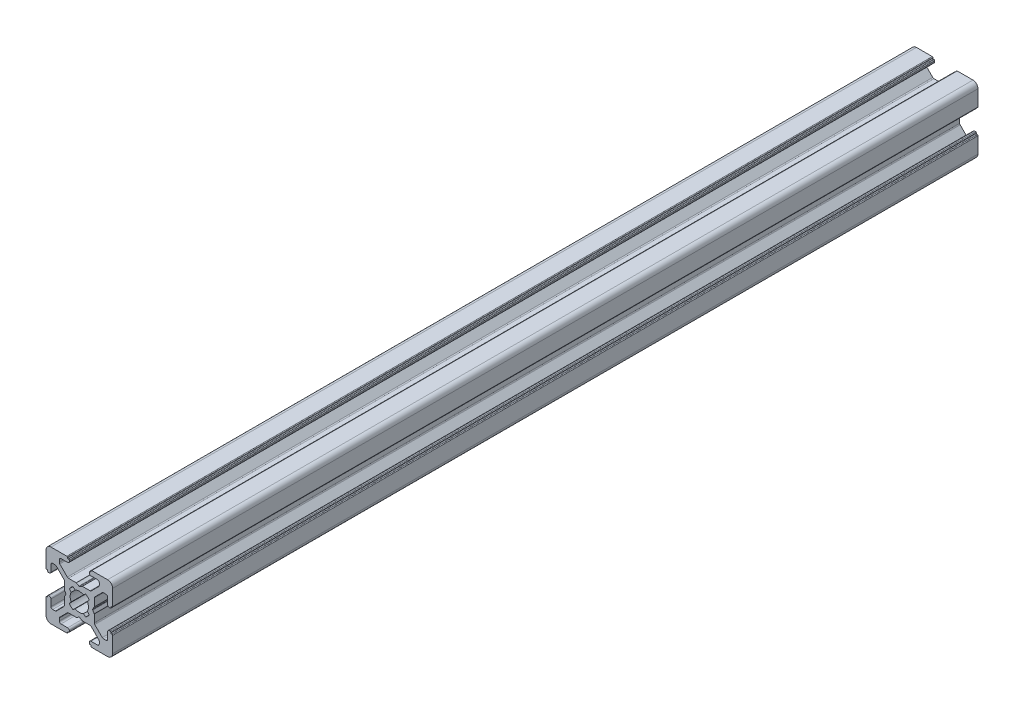
from build123d import *

# Parameters (mm, degrees)
EXTRUDE1_DEPTH = 260


with BuildPart() as part:
    # Sketch1 → Extrude1 (new body)
    with BuildSketch(Plane.XY):
        with BuildLine():
            Line((-3.5, 8.499999673), (-5.500000686, 8.499999673))
            ThreePointArc((-5.500000686, 8.499999673), (-5.853554077, 8.353553064), (-6.000000686, 7.999999673))
            Line((-6.000000686, 7.999999673), (-6.000000686, 7.267766626))
            ThreePointArc((-6.000000686, 7.267766626), (-5.961940448, 7.076424899), (-5.853554059, 6.914213219))
            Line((-5.853554059, 6.914213219), (-3.585787212, 4.646446592))
            ThreePointArc((-3.585787212, 4.646446592), (-3.423575544, 4.538060229), (-3.232233839, 4.5))
            Line((-3.232233839, 4.5), (-0.953590312, 4.5))
            ThreePointArc((-0.953590312, 4.5), (-0.901826505, 4.493185166), (-0.853590316, 4.473205083))
            Line((-0.853590316, 4.473205083), (-0.100000045, 4.038119562))
            ThreePointArc((-0.100000045, 4.038119562), (0, 4.011324632), (0.100000045, 4.038119562))
            Line((0.100000045, 4.038119562), (0.853590316, 4.473205083))
            ThreePointArc((0.853590316, 4.473205083), (0.901826505, 4.493185166), (0.953590312, 4.5))
            Line((0.953590312, 4.5), (3.232233839, 4.5))
            ThreePointArc((3.232233839, 4.5), (3.423575544, 4.538060229), (3.585787212, 4.646446592))
            Line((3.585787212, 4.646446592), (5.853554059, 6.914213219))
            ThreePointArc((5.853554059, 6.914213219), (5.961940448, 7.076424899), (6.000000686, 7.267766626))
            Line((6.000000686, 7.267766626), (6.000000686, 7.999999673))
            ThreePointArc((6.000000686, 7.999999673), (5.853554077, 8.353553064), (5.500000686, 8.499999673))
            Line((5.500000686, 8.499999673), (3.5, 8.499999673))
            ThreePointArc((3.5, 8.499999673), (3.146446609, 8.646446283), (3, 8.999999673))
            Line((3, 8.999999673), (3, 9.3))
            ThreePointArc((3, 9.3), (3.058578644, 9.441421356), (3.2, 9.5))
            Line((3.2, 9.5), (3.350000228, 9.5))
            ThreePointArc((3.350000228, 9.5), (3.491421584, 9.558578644), (3.550000228, 9.7))
            Line((3.550000228, 9.7), (3.550000228, 9.8))
            ThreePointArc((3.550000228, 9.8), (3.608578871, 9.941421356), (3.750000228, 10))
            Line((3.750000228, 10), (8.5, 10))
            ThreePointArc((8.5, 10), (9.560660172, 9.560660172), (10, 8.5))
            Line((10, 8.5), (10, 3.749999605))
            ThreePointArc((10, 3.749999605), (9.941421356, 3.608578248), (9.8, 3.549999605))
            Line((9.8, 3.549999605), (9.699999732, 3.549999605))
            ThreePointArc((9.699999732, 3.549999605), (9.558578376, 3.491420961), (9.499999732, 3.349999605))
            Line((9.499999732, 3.349999605), (9.499999732, 3.2))
            ThreePointArc((9.499999732, 3.2), (9.441421088, 3.058578644), (9.299999732, 3))
            Line((9.299999732, 3), (8.999999732, 3))
            ThreePointArc((8.999999732, 3), (8.646446341, 3.146446609), (8.499999732, 3.5))
            Line((8.499999732, 3.5), (8.499999732, 5.499999605))
            ThreePointArc((8.499999732, 5.499999605), (8.353553123, 5.853552995), (7.999999732, 5.999999605))
            Line((7.999999732, 5.999999605), (7.267766685, 5.999999605))
            ThreePointArc((7.267766685, 5.999999605), (7.076424969, 5.961939371), (6.914213294, 5.853552995))
            Line((6.914213294, 5.853552995), (4.646446398, 3.585786099))
            ThreePointArc((4.646446398, 3.585786099), (4.538060023, 3.423574425), (4.499999789, 3.232232708))
            Line((4.499999789, 3.232232708), (4.499999789, 0.953589302))
            ThreePointArc((4.499999789, 0.953589302), (4.493184953, 0.90182549), (4.473204867, 0.853589297))
            Line((4.473204867, 0.853589297), (4.038119841, 0.099999969))
            ThreePointArc((4.038119841, 0.099999969), (4.011324929, 0), (4.038119841, -0.099999969))
            Line((4.038119841, -0.099999969), (4.473204867, -0.853589297))
            ThreePointArc((4.473204867, -0.853589297), (4.493184953, -0.90182549), (4.499999789, -0.953589302))
            Line((4.499999789, -0.953589302), (4.499999789, -3.232232708))
            ThreePointArc((4.499999789, -3.232232708), (4.538060023, -3.423574425), (4.646446398, -3.585786099))
            Line((4.646446398, -3.585786099), (6.914213294, -5.853552995))
            ThreePointArc((6.914213294, -5.853552995), (7.076424969, -5.961939371), (7.267766685, -5.999999605))
            Line((7.267766685, -5.999999605), (7.999999732, -5.999999605))
            ThreePointArc((7.999999732, -5.999999605), (8.353553123, -5.853552995), (8.499999732, -5.499999605))
            Line((8.499999732, -5.499999605), (8.499999732, -3.5))
            ThreePointArc((8.499999732, -3.5), (8.646446341, -3.146446609), (8.999999732, -3))
            Line((8.999999732, -3), (9.299999732, -3))
            ThreePointArc((9.299999732, -3), (9.441421088, -3.058578644), (9.499999732, -3.2))
            Line((9.499999732, -3.2), (9.499999732, -3.349999605))
            ThreePointArc((9.499999732, -3.349999605), (9.558578376, -3.491420961), (9.699999732, -3.549999605))
            Line((9.699999732, -3.549999605), (9.8, -3.549999605))
            ThreePointArc((9.8, -3.549999605), (9.941421356, -3.608578248), (10, -3.749999605))
            Line((10, -3.749999605), (10, -8.5))
            ThreePointArc((10, -8.5), (9.560660172, -9.560660172), (8.5, -10))
            Line((8.5, -10), (3.750000228, -10))
            ThreePointArc((3.750000228, -10), (3.608578871, -9.941421356), (3.550000228, -9.8))
            Line((3.550000228, -9.8), (3.550000228, -9.7))
            ThreePointArc((3.550000228, -9.7), (3.491421584, -9.558578644), (3.350000228, -9.5))
            Line((3.350000228, -9.5), (3.2, -9.5))
            ThreePointArc((3.2, -9.5), (3.058578644, -9.441421356), (3, -9.3))
            Line((3, -9.3), (3, -8.999999673))
            ThreePointArc((3, -8.999999673), (3.146446609, -8.646446283), (3.5, -8.499999673))
            Line((3.5, -8.499999673), (5.500000686, -8.499999673))
            ThreePointArc((5.500000686, -8.499999673), (5.853554077, -8.353553064), (6.000000686, -7.999999673))
            Line((6.000000686, -7.999999673), (6.000000686, -7.267766626))
            ThreePointArc((6.000000686, -7.267766626), (5.961940448, -7.076424899), (5.853554059, -6.914213219))
            Line((5.853554059, -6.914213219), (3.585787212, -4.646446592))
            ThreePointArc((3.585787212, -4.646446592), (3.423575544, -4.538060229), (3.232233839, -4.5))
            Line((3.232233839, -4.5), (0.953590312, -4.5))
            ThreePointArc((0.953590312, -4.5), (0.901826505, -4.493185166), (0.853590316, -4.473205083))
            Line((0.853590316, -4.473205083), (0.100000045, -4.038119562))
            ThreePointArc((0.100000045, -4.038119562), (0, -4.011324632), (-0.100000045, -4.038119562))
            Line((-0.100000045, -4.038119562), (-0.853590316, -4.473205083))
            ThreePointArc((-0.853590316, -4.473205083), (-0.901826505, -4.493185166), (-0.953590312, -4.5))
            Line((-0.953590312, -4.5), (-3.232233839, -4.5))
            ThreePointArc((-3.232233839, -4.5), (-3.423575544, -4.538060229), (-3.585787212, -4.646446592))
            Line((-3.585787212, -4.646446592), (-5.853554059, -6.914213219))
            ThreePointArc((-5.853554059, -6.914213219), (-5.961940448, -7.076424899), (-6.000000686, -7.267766626))
            Line((-6.000000686, -7.267766626), (-6.000000686, -7.999999673))
            ThreePointArc((-6.000000686, -7.999999673), (-5.853554077, -8.353553064), (-5.500000686, -8.499999673))
            Line((-5.500000686, -8.499999673), (-3.5, -8.499999673))
            ThreePointArc((-3.5, -8.499999673), (-3.146446609, -8.646446283), (-3, -8.999999673))
            Line((-3, -8.999999673), (-3, -9.3))
            ThreePointArc((-3, -9.3), (-3.058578644, -9.441421356), (-3.2, -9.5))
            Line((-3.2, -9.5), (-3.350000228, -9.5))
            ThreePointArc((-3.350000228, -9.5), (-3.491421584, -9.558578644), (-3.550000228, -9.7))
            Line((-3.550000228, -9.7), (-3.550000228, -9.8))
            ThreePointArc((-3.550000228, -9.8), (-3.608578871, -9.941421356), (-3.750000228, -10))
            Line((-3.750000228, -10), (-8.5, -10))
            ThreePointArc((-8.5, -10), (-9.560660172, -9.560660172), (-10, -8.5))
            Line((-10, -8.5), (-10, -3.749999605))
            ThreePointArc((-10, -3.749999605), (-9.941421356, -3.608578248), (-9.8, -3.549999605))
            Line((-9.8, -3.549999605), (-9.699999732, -3.549999605))
            ThreePointArc((-9.699999732, -3.549999605), (-9.558578376, -3.491420961), (-9.499999732, -3.349999605))
            Line((-9.499999732, -3.349999605), (-9.499999732, -3.2))
            ThreePointArc((-9.499999732, -3.2), (-9.441421088, -3.058578644), (-9.299999732, -3))
            Line((-9.299999732, -3), (-8.999999732, -3))
            ThreePointArc((-8.999999732, -3), (-8.646446341, -3.146446609), (-8.499999732, -3.5))
            Line((-8.499999732, -3.5), (-8.499999732, -5.499999605))
            ThreePointArc((-8.499999732, -5.499999605), (-8.353553123, -5.853552995), (-7.999999732, -5.999999605))
            Line((-7.999999732, -5.999999605), (-7.267766685, -5.999999605))
            ThreePointArc((-7.267766685, -5.999999605), (-7.076424969, -5.961939371), (-6.914213294, -5.853552995))
            Line((-6.914213294, -5.853552995), (-4.646446398, -3.585786099))
            ThreePointArc((-4.646446398, -3.585786099), (-4.538060023, -3.423574425), (-4.499999789, -3.232232708))
            Line((-4.499999789, -3.232232708), (-4.499999789, -0.953589302))
            ThreePointArc((-4.499999789, -0.953589302), (-4.493184953, -0.90182549), (-4.473204867, -0.853589297))
            Line((-4.473204867, -0.853589297), (-4.038119841, -0.099999969))
            ThreePointArc((-4.038119841, -0.099999969), (-4.011324929, 0), (-4.038119841, 0.099999969))
            Line((-4.038119841, 0.099999969), (-4.473204867, 0.853589297))
            ThreePointArc((-4.473204867, 0.853589297), (-4.493184953, 0.90182549), (-4.499999789, 0.953589302))
            Line((-4.499999789, 0.953589302), (-4.499999789, 3.232232708))
            ThreePointArc((-4.499999789, 3.232232708), (-4.538060023, 3.423574425), (-4.646446398, 3.585786099))
            Line((-4.646446398, 3.585786099), (-6.914213294, 5.853552995))
            ThreePointArc((-6.914213294, 5.853552995), (-7.076424969, 5.961939371), (-7.267766685, 5.999999605))
            Line((-7.267766685, 5.999999605), (-7.999999732, 5.999999605))
            ThreePointArc((-7.999999732, 5.999999605), (-8.353553123, 5.853552995), (-8.499999732, 5.499999605))
            Line((-8.499999732, 5.499999605), (-8.499999732, 3.5))
            ThreePointArc((-8.499999732, 3.5), (-8.646446341, 3.146446609), (-8.999999732, 3))
            Line((-8.999999732, 3), (-9.299999732, 3))
            ThreePointArc((-9.299999732, 3), (-9.441421088, 3.058578644), (-9.499999732, 3.2))
            Line((-9.499999732, 3.2), (-9.499999732, 3.349999605))
            ThreePointArc((-9.499999732, 3.349999605), (-9.558578376, 3.491420961), (-9.699999732, 3.549999605))
            Line((-9.699999732, 3.549999605), (-9.8, 3.549999605))
            ThreePointArc((-9.8, 3.549999605), (-9.941421356, 3.608578248), (-10, 3.749999605))
            Line((-10, 3.749999605), (-10, 8.5))
            ThreePointArc((-10, 8.5), (-9.560660172, 9.560660172), (-8.5, 10))
            Line((-8.5, 10), (-3.750000228, 10))
            ThreePointArc((-3.750000228, 10), (-3.608578871, 9.941421356), (-3.550000228, 9.8))
            Line((-3.550000228, 9.8), (-3.550000228, 9.7))
            ThreePointArc((-3.550000228, 9.7), (-3.491421584, 9.558578644), (-3.350000228, 9.5))
            Line((-3.350000228, 9.5), (-3.2, 9.5))
            ThreePointArc((-3.2, 9.5), (-3.058578644, 9.441421356), (-3, 9.3))
            Line((-3, 9.3), (-3, 8.999999673))
            ThreePointArc((-3, 8.999999673), (-3.146446609, 8.646446283), (-3.5, 8.499999673))
        make_face()
        with BuildLine():
            Line((-1.258185436, 2.445295362), (-1.91389502, 2.989640962))
            ThreePointArc((-1.91389502, 2.989640962), (-2.511737261, 2.508410485), (-2.992174953, 1.909930962))
            Line((-2.992174953, 1.909930962), (-2.445295423, 1.258185317))
            ThreePointArc((-2.445295423, 1.258185317), (-2.75, 0), (-2.445295423, -1.258185317))
            Line((-2.445295423, -1.258185317), (-2.992174953, -1.909930962))
            ThreePointArc((-2.992174953, -1.909930962), (-2.511737261, -2.508410485), (-1.91389502, -2.989640962))
            Line((-1.91389502, -2.989640962), (-1.258185436, -2.445295362))
            ThreePointArc((-1.258185436, -2.445295362), (0, -2.75), (1.258185436, -2.445295362))
            Line((1.258185436, -2.445295362), (1.91389502, -2.989640962))
            ThreePointArc((1.91389502, -2.989640962), (2.511737261, -2.508410485), (2.992174953, -1.909930962))
            Line((2.992174953, -1.909930962), (2.445295423, -1.258185317))
            ThreePointArc((2.445295423, -1.258185317), (2.75, 0), (2.445295423, 1.258185317))
            Line((2.445295423, 1.258185317), (2.992174953, 1.909930962))
            ThreePointArc((2.992174953, 1.909930962), (2.511737261, 2.508410485), (1.91389502, 2.989640962))
            Line((1.91389502, 2.989640962), (1.258185436, 2.445295362))
            ThreePointArc((1.258185436, 2.445295362), (0, 2.75), (-1.258185436, 2.445295362))
        make_face(mode=Mode.SUBTRACT)
    extrude(amount=EXTRUDE1_DEPTH)


solid = part.part
